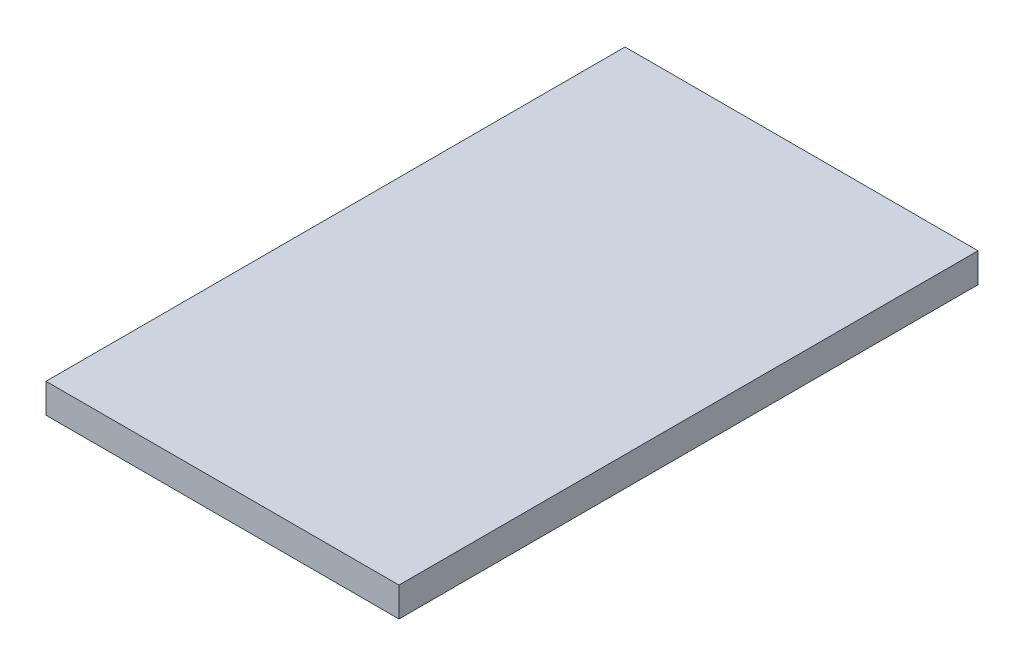
from build123d import *

# Parameters (mm, degrees)
SKETCH1_W           = 15.24
SKETCH1_H           = 25
BOSS_EXTRUDE1_DEPTH = 0.635


with BuildPart() as part:
    # Sketch1 → Boss-Extrude1 (new, symmetric)
    with BuildSketch(Plane(origin=(0, 0, 0), x_dir=(1, 0, 0), z_dir=(0, 1, 0))):
        Rectangle(SKETCH1_W, SKETCH1_H)
    extrude(amount=BOSS_EXTRUDE1_DEPTH, both=True)


solid = part.part
